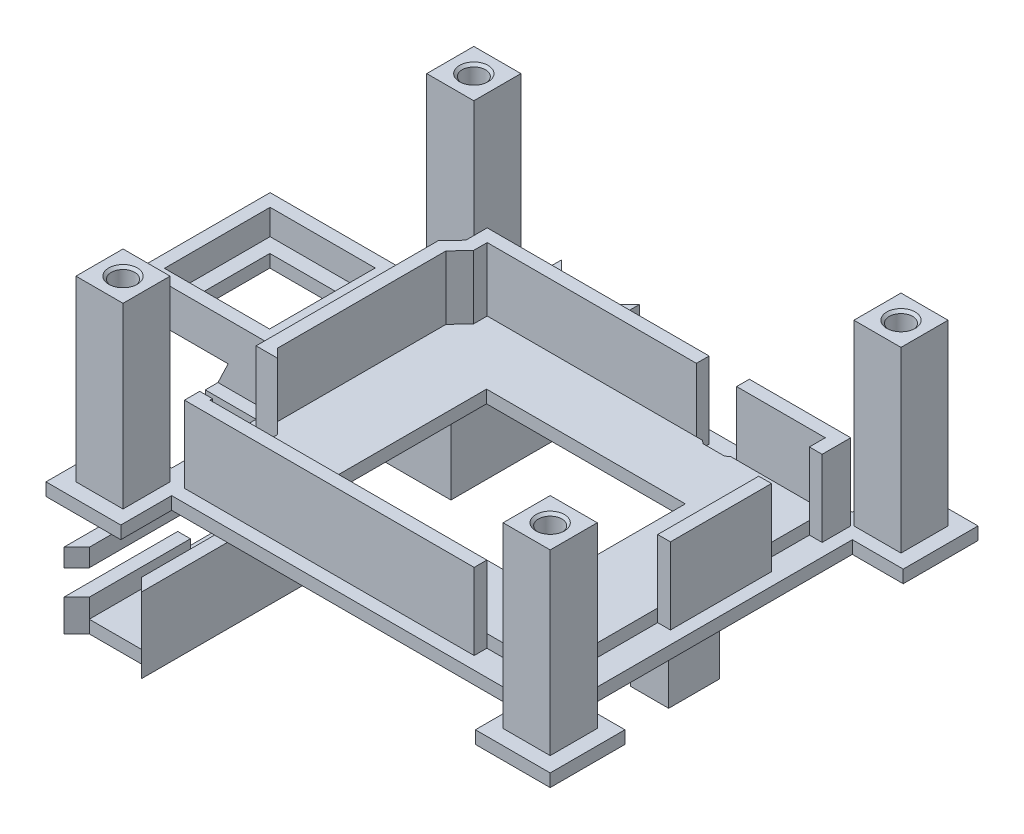
from build123d import *

# Parameters (mm, degrees)
BOSS_EXTRUDE4_DEPTH  = 2.5
SKETCH1_5_W          = 2.5
SKETCH1_5_H          = 19.85
BOSS_EXTRUDE5_DEPTH  = 12.5
SKETCH2_W            = 39.05
SKETCH2_H            = 29.05
CUT_EXTRUDE1_DEPTH   = 12.5
SKETCH3_W            = 25.65
SKETCH3_H            = 25.76
SKETCH3_W_2          = 20.65
SKETCH3_H_2          = 20.76
BOSS_EXTRUDE6_DEPTH  = 4.175
SKETCH3_3_W          = 25.65
SKETCH3_3_H          = 25.76
SKETCH3_3_W_2        = 20.65
SKETCH3_3_H_2        = 20.76
BOSS_EXTRUDE7_DEPTH  = 9.17
SKETCH5_W            = 25.65
SKETCH5_H            = 25.76
CUT_EXTRUDE2_DEPTH   = 1.68
SKETCH6_W            = 15
SKETCH6_H            = 15
CUT_EXTRUDE3_DEPTH   = 2.495
BOSS_EXTRUDE8_REACH  = 84.878
SKETCH7_W            = 25.76
SKETCH7_H            = 7.49
SKETCH8_W            = 99.05
SKETCH8_H            = 84.05
SKETCH8_W_2          = 49.05
SKETCH8_H_2          = 39.05
BOSS_EXTRUDE10_DEPTH = 2.5
BOSS_EXTRUDE11_REACH = 91.073
SKETCH10_W           = 9.25
SKETCH10_H           = 9.25
BOSS_EXTRUDE12_DEPTH = 35
SKETCH11_R           = 2.3
CUT_EXTRUDE5_DEPTH   = 6.2
CHAMFER3_SIZE        = 0.5
SKETCH13_W           = 69.67
SKETCH13_H           = 10
SKETCH13_W_2         = 10
SKETCH13_H_2         = 54.67
SKETCH13_H_3         = 16.600623632
SKETCH13_H_4         = 7.309376368
CUT_EXTRUDE6_DEPTH   = 10
BOSS_EXTRUDE13_DEPTH = 12.25
SKETCH16_W           = 10.25
SKETCH16_H           = 32
BOSS_EXTRUDE15_DEPTH = 2.5
SKETCH18_W           = 9
SKETCH18_H           = 12
CUT_EXTRUDE9_DEPTH   = 105.173233126
CUT_EXTRUDE10_REACH  = 108.352
SKETCH21_W           = 22.375
SKETCH21_H           = 5
SKETCH23_W           = 7.5
SKETCH23_H           = 10
BOSS_EXTRUDE17_DEPTH = 11.9


with BuildPart() as part:
    # Sketch1 → Boss-Extrude4 (new body)
    with BuildSketch(Plane.XZ):
        Polygon((-34.825, 26.525), (-32.325, 26.525), (-32.325, 13.750955897), (-32.813888889, 13.250955897), (-37.025, 13.250955897), (-37.025, -22.542203162), (-34.395, -25.332203162), (-34.395, -29.525), (9.2, -29.525), (9.2, -27.025), (10.366666667, -27.025), (11.066666667, -26.5), (15.233333333, -26.5), (15.933333333, -27.025), (17.1, -27.025), (17.1, -29.525), (37.025, -29.525), (37.025, -23.9), (34.525, -23.9), (34.525, -13.95), (37.025, -13.95), (37.025, 5.9), (34.525, 5.9), (34.525, 24.8), (37.025, 24.8), (37.025, 29.525), (29.39, 29.525), (29.39, 27.025), (22.09, 27.025), (22.09, 29.525), (-34.825, 29.525), align=None)
    extrude(amount=BOSS_EXTRUDE4_DEPTH)

    # Sketch1<5> → Boss-Extrude5 (add)
    with BuildSketch(Plane.XZ):
        Polygon((-32.325, 26.525), (-32.325, 27.025), (22.09, 27.025), (22.09, 29.525), (-34.825, 29.525), (-34.825, 26.525), align=None)
        Polygon((29.39, 29.525), (29.39, 27.025), (34.525, 27.025), (34.525, 24.8), (37.025, 24.8), (37.025, 29.525), align=None)
        Polygon((-34.525, 11.500955897), (-32.813888889, 13.250955897), (-37.025, 13.250955897), (-37.025, -22.542203162), (-34.395, -25.332203162), (-34.395, -29.525), (9.2, -29.525), (9.2, -27.025), (-31.895, -27.025), (-31.895, -24.339628722), (-34.525, -21.549628722), align=None)
        with Locations((35.775, -4.025)):
            Rectangle(SKETCH1_5_W, SKETCH1_5_H)
        Polygon((37.025, -23.9), (34.525, -23.9), (34.525, -27.025), (17.1, -27.025), (17.1, -29.525), (37.025, -29.525), align=None)
    extrude(amount=-BOSS_EXTRUDE5_DEPTH)

    # Sketch2 → Cut-Extrude1 (cut)
    with BuildSketch(Plane(origin=(0, 0, 0), x_dir=(1, 0, 0), z_dir=(0, 1, 0))):
        Rectangle(SKETCH2_W, SKETCH2_H)
    extrude(amount=-CUT_EXTRUDE1_DEPTH, mode=Mode.SUBTRACT)

    # Sketch7 → Boss-Extrude8 (add, up to next)
    with BuildSketch(Plane(origin=(-39.399999906, 0, 0), x_dir=(0, 0, -1), z_dir=(1, 0, 0)), mode=Mode.PRIVATE) as boss_extrude8_sk1:
        with Locations((4.645623632, 5.425)):
            Rectangle(SKETCH7_W, SKETCH7_H)
    boss_extrude8_tool1 = extrude(boss_extrude8_sk1.sketch, amount=BOSS_EXTRUDE8_REACH, mode=Mode.PRIVATE) - part.part


with BuildPart() as body_2:
    # Sketch3 → Boss-Extrude6 (new body)
    # profile 1 of 2: a face of its own
    with BuildSketch(Plane(origin=(0, 0, 0), x_dir=(1, 0, 0), z_dir=(0, 1, 0))):
        with Locations((-52.224999906, 4.645623632)):
            Rectangle(SKETCH3_W, SKETCH3_H)
        with Locations((-52.224999906, 4.645623632)):
            Rectangle(SKETCH3_W_2, SKETCH3_H_2, mode=Mode.SUBTRACT)
    # profile 2 of 2: a face of its own
    with BuildSketch(Plane(origin=(0, 0, 0), x_dir=(1, 0, 0), z_dir=(0, 1, 0))):
        with Locations((-52.224999906, 4.645623632)):
            Rectangle(SKETCH3_W_2, SKETCH3_H_2)
    extrude(amount=BOSS_EXTRUDE6_DEPTH)

    # Sketch3<3> → Boss-Extrude7 (add)
    with BuildSketch(Plane(origin=(0, 0, 0), x_dir=(1, 0, 0), z_dir=(0, 1, 0))):
        with Locations((-52.224999906, 4.645623632)):
            Rectangle(SKETCH3_3_W, SKETCH3_3_H)
        with Locations((-52.224999906, 4.645623632)):
            Rectangle(SKETCH3_3_W_2, SKETCH3_3_H_2, mode=Mode.SUBTRACT)
    extrude(amount=BOSS_EXTRUDE7_DEPTH)

    # Sketch5 → Cut-Extrude2 (cut)
    with BuildSketch(Plane.XZ):
        with Locations((-52.224999906, -4.645623632)):
            Rectangle(SKETCH5_W, SKETCH5_H)
    extrude(amount=-CUT_EXTRUDE2_DEPTH, mode=Mode.SUBTRACT)

    # Sketch6 → Cut-Extrude3 (cut)
    with BuildSketch(Plane.XZ.offset(-1.68)):
        with Locations((-52.224999906, -4.645623632)):
            Rectangle(SKETCH6_W, SKETCH6_H)
    extrude(amount=-CUT_EXTRUDE3_DEPTH, mode=Mode.SUBTRACT)


with BuildPart() as part_1:
    add(part.part)

    add(body_2.part)  # Boss-Extrude8 merges body 2
    add(boss_extrude8_tool1.solids().sort_by_distance((-39.4, 5.425, -4.645624))[0])

    # Sketch8 → Boss-Extrude10 (add)
    with BuildSketch(Plane.XZ.offset(2.5)):
        Rectangle(SKETCH8_W, SKETCH8_H)
        Rectangle(SKETCH8_W_2, SKETCH8_H_2, mode=Mode.SUBTRACT)
    extrude(amount=BOSS_EXTRUDE10_DEPTH)

    # Boss-Extrude11: up to this face of the body (flat: up to its plane)
    boss_extrude11_end = Plane(part_1.part.faces().sort_by_distance((-51.037499953, 5.425, 8.234376368))[0])
    # Sketch9 → Boss-Extrude11 (add, up to the picked face)
    with BuildSketch(Plane(origin=(0, 0, -17.525623632), x_dir=(-1, 0, 0), z_dir=(0, 0, -1)), mode=Mode.PRIVATE) as boss_extrude11_sk1:
        Polygon((47.534374965, 1.68), (37.025, 1.68), (37.025, -2.5), (49.525, -2.5), align=None)
    boss_extrude11_tool1 = split(extrude(boss_extrude11_sk1.sketch, amount=-BOSS_EXTRUDE11_REACH, mode=Mode.PRIVATE), bisect_by=boss_extrude11_end, keep=Keep.BOTH, mode=Mode.PRIVATE)
    add(boss_extrude11_tool1.solids().sort_by(Axis((-42.791695, -0.470271, -17.525624), (0, 0, 1)))[0])

    # Sketch10 → Boss-Extrude12 (add)
    with BuildSketch(Plane(origin=(0, -2.5, 0), x_dir=(1, 0, 0), z_dir=(0, 1, 0))):
        with Locations((-41.96, 34.46)):
            Rectangle(SKETCH10_W, SKETCH10_H)
        with Locations((41.96, 34.46)):
            Rectangle(SKETCH10_W, SKETCH10_H)
        with Locations((-41.96, -34.46)):
            Rectangle(SKETCH10_W, SKETCH10_H)
        with Locations((41.96, -34.46)):
            Rectangle(SKETCH10_W, SKETCH10_H)
    extrude(amount=BOSS_EXTRUDE12_DEPTH)

    # Sketch11 → Cut-Extrude5 (cut)
    with BuildSketch(Plane(origin=(0, 32.5, 0), x_dir=(1, 0, 0), z_dir=(0, 1, 0))):
        with BuildLine():
            ThreePointArc((-39.66, 34.46), (-40.333654403, 36.086345597), (-41.96, 36.76))
            Line((-41.96, 36.76), (-41.96, 34.46))
            Line((-41.96, 34.46), (-39.66, 34.46))
        make_face()
        with BuildLine():
            Line((-41.96, 34.46), (-41.96, 36.76))
            ThreePointArc((-41.96, 36.76), (-43.586345597, 36.086345597), (-44.26, 34.46))
            Line((-44.26, 34.46), (-41.96, 34.46))
        make_face()
        with BuildLine():
            Line((-39.66, 34.46), (-41.96, 34.46))
            Line((-41.96, 34.46), (-41.96, 32.16))
            ThreePointArc((-41.96, 32.16), (-40.333654403, 32.833654403), (-39.66, 34.46))
        make_face()
        with BuildLine():
            Line((-41.96, 32.16), (-41.96, 34.46))
            Line((-41.96, 34.46), (-44.26, 34.46))
            ThreePointArc((-44.26, 34.46), (-43.586345597, 32.833654403), (-41.96, 32.16))
        make_face()
        with Locations(Location((-41.96, -34.46, 0), (0, 0, 270))):
            Circle(SKETCH11_R)
        with Locations(Location((41.96, -34.46, 0), (0, 0, 270))):
            Circle(SKETCH11_R)
        with Locations(Location((41.96, 34.46, 0), (0, 0, 270))):
            Circle(SKETCH11_R)
    extrude(amount=-CUT_EXTRUDE5_DEPTH, mode=Mode.SUBTRACT)

    # Chamfer3
    chamfer3_edges = [part_1.edges().sort_by_distance(p)[0] for p in [
        (41.96, 32.5, -36.76),
        (41.96, 32.5, 32.16),
        (-41.96, 32.5, 32.16),
        (-39.66, 32.5, -34.46),
    ]]
    chamfer(chamfer3_edges, length=CHAMFER3_SIZE)

    # Sketch13 → Cut-Extrude6 (cut)
    with BuildSketch(Plane(origin=(0, -2.5, 0), x_dir=(1, 0, 0), z_dir=(0, 1, 0))):
        with Locations((0, 37.025)):
            Rectangle(SKETCH13_W, SKETCH13_H)
        with Locations((44.525, 0)):
            Rectangle(SKETCH13_W_2, SKETCH13_H_2)
        with Locations((0, -37.025)):
            Rectangle(SKETCH13_W, SKETCH13_H)
        with Locations((-44.525, -19.034688184)):
            Rectangle(SKETCH13_W_2, SKETCH13_H_3)
        with Locations((-44.525, 23.680311816)):
            Rectangle(SKETCH13_W_2, SKETCH13_H_4)
    extrude(amount=-CUT_EXTRUDE6_DEPTH, mode=Mode.SUBTRACT)

    # Sketch14 → Boss-Extrude13 (add)
    with BuildSketch(Plane.XZ.offset(5)):
        Polygon((-39.15, 48.9), (-39.15, 11.9), (-23.9, 11.9), (-23.9, 48.9), (-26.4, 46.4), (-26.4, 14.4), (-36.65, 14.4), (-36.65, 46.4), align=None)
        Polygon((-39.15, -11.9), (-39.15, -48.9), (-36.65, -46.4), (-36.65, -14.4), (-26.4, -14.4), (-26.4, -46.4), (-23.9, -48.9), (-23.9, -11.9), align=None)
    extrude(amount=BOSS_EXTRUDE13_DEPTH)

    # Sketch16 → Boss-Extrude15 (add)
    with BuildSketch(Plane.XZ.offset(17.25)):
        Polygon((-23.9, 11.9), (-23.9, 48.9), (-26.4, 46.4), (-26.4, 14.4), (-36.65, 14.4), (-36.65, 46.4), (-39.15, 48.9), (-39.15, 11.9), align=None)
        Polygon((-26.4, -46.4), (-23.9, -48.9), (-23.9, -11.9), (-39.15, -11.9), (-39.15, -48.9), (-36.65, -46.4), (-36.65, -14.4), (-26.4, -14.4), align=None)
        with Locations((-31.525, 30.4)):
            Rectangle(SKETCH16_W, SKETCH16_H)
        with Locations((-31.525, -30.4)):
            Rectangle(SKETCH16_W, SKETCH16_H)
    extrude(amount=BOSS_EXTRUDE15_DEPTH)

    # Sketch18 → Cut-Extrude9 (cut, through all)
    with BuildSketch(Plane.ZY.offset(36.525)):
        with Locations((-22.025, -11.125)):
            Rectangle(SKETCH18_W, SKETCH18_H)
        with Locations((22.025, -11.125)):
            Rectangle(SKETCH18_W, SKETCH18_H)
    extrude(amount=CUT_EXTRUDE9_DEPTH, mode=Mode.SUBTRACT)

    # Sketch21 → Cut-Extrude10 (cut, up to next)
    with BuildSketch(Plane.ZY.offset(39.15), mode=Mode.PRIVATE) as cut_extrude10_sk1:
        with Locations((-37.7125, -11)):
            Rectangle(SKETCH21_W, SKETCH21_H)
    cut_extrude10_tool1 = extrude(cut_extrude10_sk1.sketch, amount=-CUT_EXTRUDE10_REACH, mode=Mode.PRIVATE) & part_1.part
    # Sketch21 → Cut-Extrude10 (cut, up to next)
    with BuildSketch(Plane.ZY.offset(39.15), mode=Mode.PRIVATE) as cut_extrude10_sk2:
        with Locations((37.7125, -11)):
            Rectangle(SKETCH21_W, SKETCH21_H)
    cut_extrude10_tool2 = extrude(cut_extrude10_sk2.sketch, amount=-CUT_EXTRUDE10_REACH, mode=Mode.PRIVATE) & part_1.part
    add(cut_extrude10_tool1.solids().sort_by_distance((-39.15, -11, -37.7125))[0], mode=Mode.SUBTRACT)
    add(cut_extrude10_tool2.solids().sort_by_distance((-39.15, -11, 37.7125))[0], mode=Mode.SUBTRACT)

    # Sketch23 → Boss-Extrude17 (add)
    with BuildSketch(Plane.XZ.offset(5)):
        with Locations((32.025, 0)):
            Rectangle(SKETCH23_W, SKETCH23_H)
    extrude(amount=BOSS_EXTRUDE17_DEPTH)


solid = part_1.part
